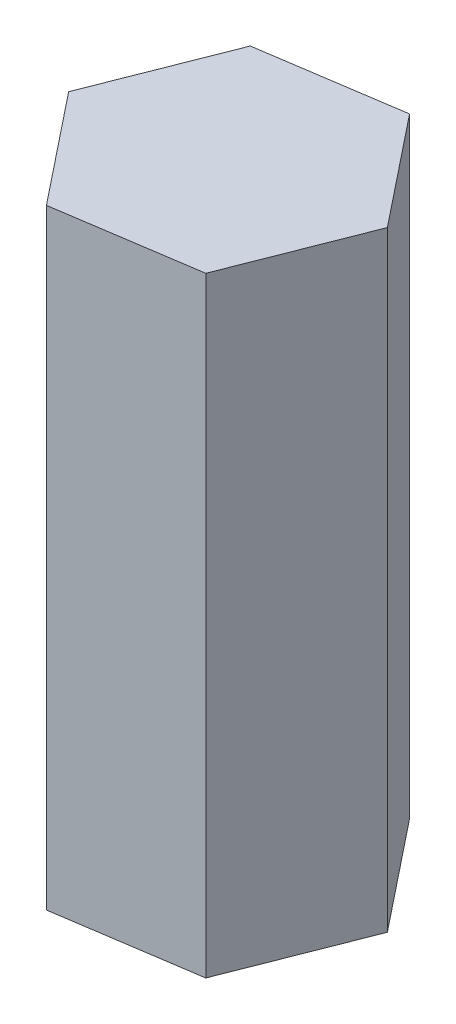
from build123d import *

# Parameters (mm, degrees)
BOSS_EXTRUDE1_DEPTH = 40


with BuildPart() as part:
    # Sketch1 → Boss-Extrude1 (new body)
    with BuildSketch(Plane(origin=(0, 0, 0), x_dir=(1, 0, 0), z_dir=(0, 1, 0))):
        Polygon((3.355019019, 8.544814064), (-5.72251654, 7.177938732), (-9.077535559, -1.366875331), (-3.355019019, -8.544814064), (5.72251654, -7.177938732), (9.077535559, 1.366875331), align=None)
    extrude(amount=BOSS_EXTRUDE1_DEPTH)


solid = part.part
